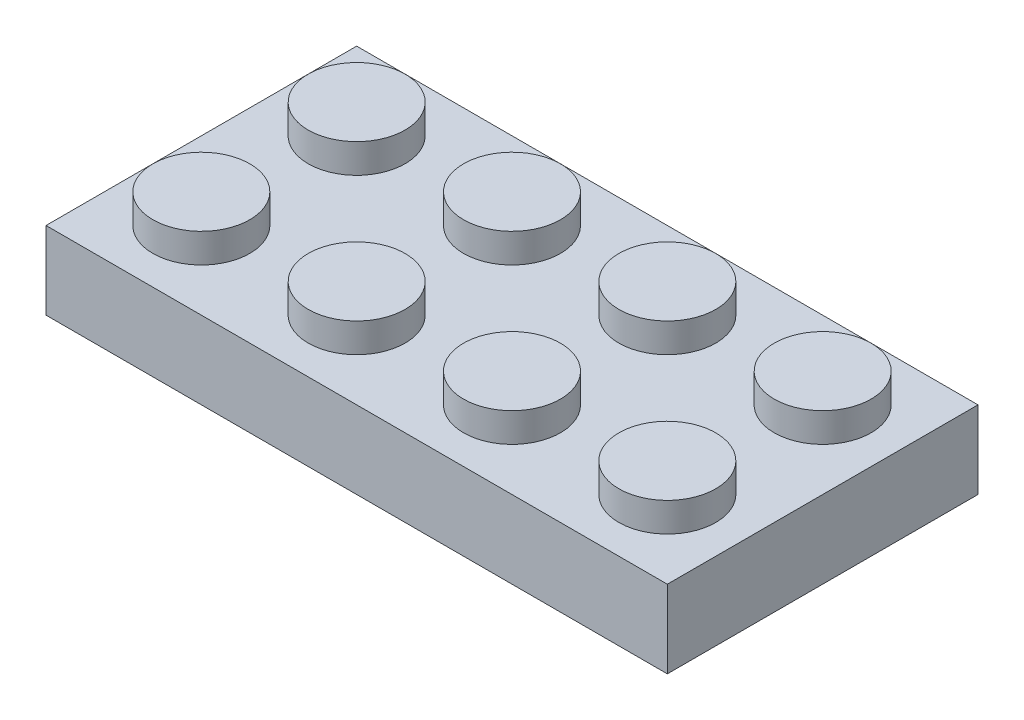
from build123d import *

# Parameters (mm, degrees)
SKETCH1_W            = 25.4
SKETCH1_H            = 12.7
BOSS_EXTRUDE1_DEPTH  = 3.175
SKETCH2_R            = 1.9812
BOSS_EXTRUDE2_DEPTH  = 1.1938
LPATTERN1_COUNT      = 4
LPATTERN1_PITCH      = 6.35
LPATTERN1_COUNT_DIR2 = 2
LPATTERN1_PITCH_DIR2 = 6.35
SHELL2_T             = -1.1938
SKETCH3_R            = 2.5019
SKETCH3_R_2          = 1.9812
BOSS_EXTRUDE3_DEPTH  = 1.9812
LPATTERN2_COUNT      = 3
LPATTERN2_PITCH      = 6.35


with BuildPart() as part:
    # Sketch1 → Boss-Extrude1 (new body)
    with BuildSketch(Plane(origin=(0, 0, 0), x_dir=(1, 0, 0), z_dir=(0, 1, 0))):
        Rectangle(SKETCH1_W, SKETCH1_H)
    extrude(amount=BOSS_EXTRUDE1_DEPTH)

    # Sketch2 → Boss-Extrude2 (add)
    with BuildSketch(Plane(origin=(0, 3.175, 0), x_dir=(1, 0, 0), z_dir=(0, 1, 0))):
        with Locations(Location((-9.525, 3.175, 0), (0, 0, 270))):
            Circle(SKETCH2_R)
    boss_extrude2 = extrude(amount=BOSS_EXTRUDE2_DEPTH)

    # LPattern1: Boss-Extrude2 4 × 2
    with Locations(*[(i * LPATTERN1_PITCH, 0, j * LPATTERN1_PITCH_DIR2) for i in range(LPATTERN1_COUNT) for j in range(LPATTERN1_COUNT_DIR2) if (i, j) != (0, 0)]):
        add(boss_extrude2)

    # Shell2
    shell2_openings = [part.faces().sort_by_distance(p)[0] for p in [
        (0, 0, 0),
    ]]
    offset(amount=SHELL2_T, openings=shell2_openings, kind=Kind.INTERSECTION)

    # Sketch3 → Boss-Extrude3 (add)
    with BuildSketch(Plane.XZ.offset(-1.9812)):
        with Locations(Location((6.35, 0, 0), (0, 0, 90))):
            Circle(SKETCH3_R)
        with Locations(Location((6.35, 0, 0), (0, 0, 90))):
            Circle(SKETCH3_R_2, mode=Mode.SUBTRACT)
    boss_extrude3 = extrude(amount=BOSS_EXTRUDE3_DEPTH)

    # LPattern2: Boss-Extrude3 ×3
    with Locations(*[(-i * LPATTERN2_PITCH, 0, 0) for i in range(1, LPATTERN2_COUNT)]):
        add(boss_extrude3)


solid = part.part
